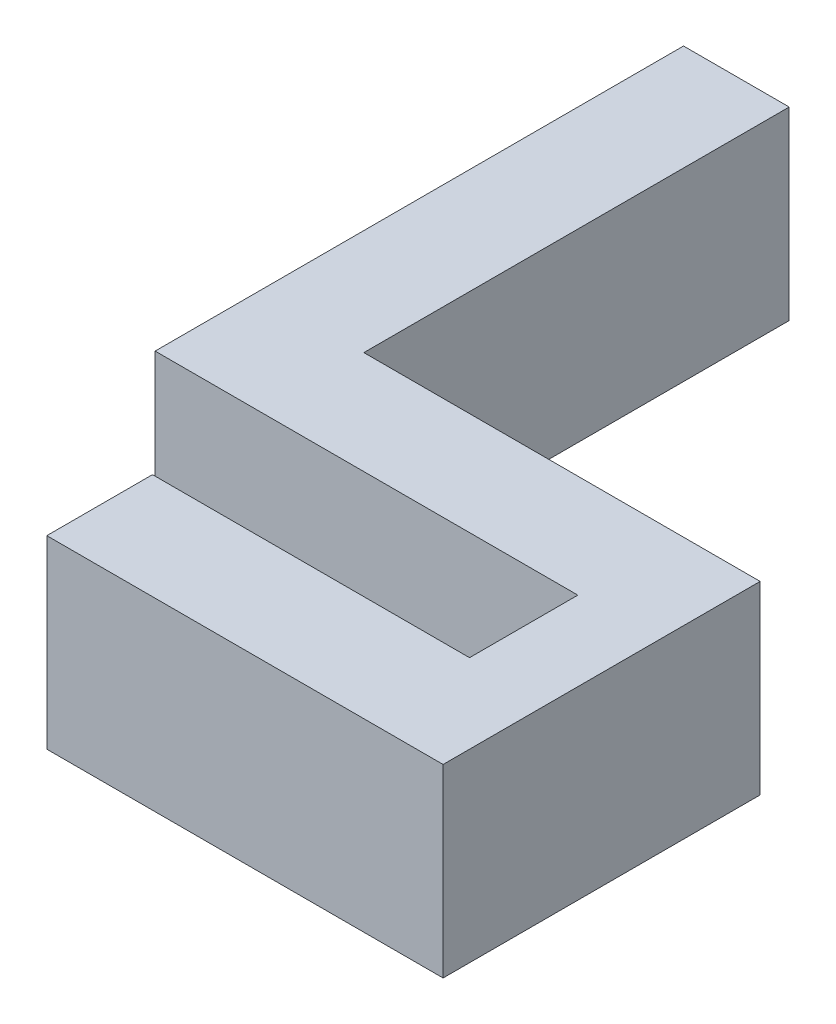
from build123d import *

# Parameters (mm, degrees)
BOSS_EXTRUDE1_DEPTH = 7
SKETCH2_W           = 12
SKETCH2_H           = 2.6
CUT_EXTRUDE1_DEPTH  = 7


with BuildPart() as part:
    # Sketch1 → Boss-Extrude1 (new body)
    with BuildSketch(Plane(origin=(0, 0, 0), x_dir=(1, 0, 0), z_dir=(0, 1, 0))):
        Polygon((0, 0), (12, 0), (12, -4.1), (0, -4.1), (0, -8.1), (15, -8.1), (15, 3.9), (1.592592593, 3.9), (0, 3.9), (0, 20), (-4, 20), (-4, 0), align=None)
    extrude(amount=BOSS_EXTRUDE1_DEPTH)

    # Sketch2 → Cut-Extrude1 (cut)
    with BuildSketch(Plane.XY):
        with Locations((6, 1.3)):
            Rectangle(SKETCH2_W, SKETCH2_H)
    extrude(amount=-CUT_EXTRUDE1_DEPTH, mode=Mode.SUBTRACT)


solid = part.part
